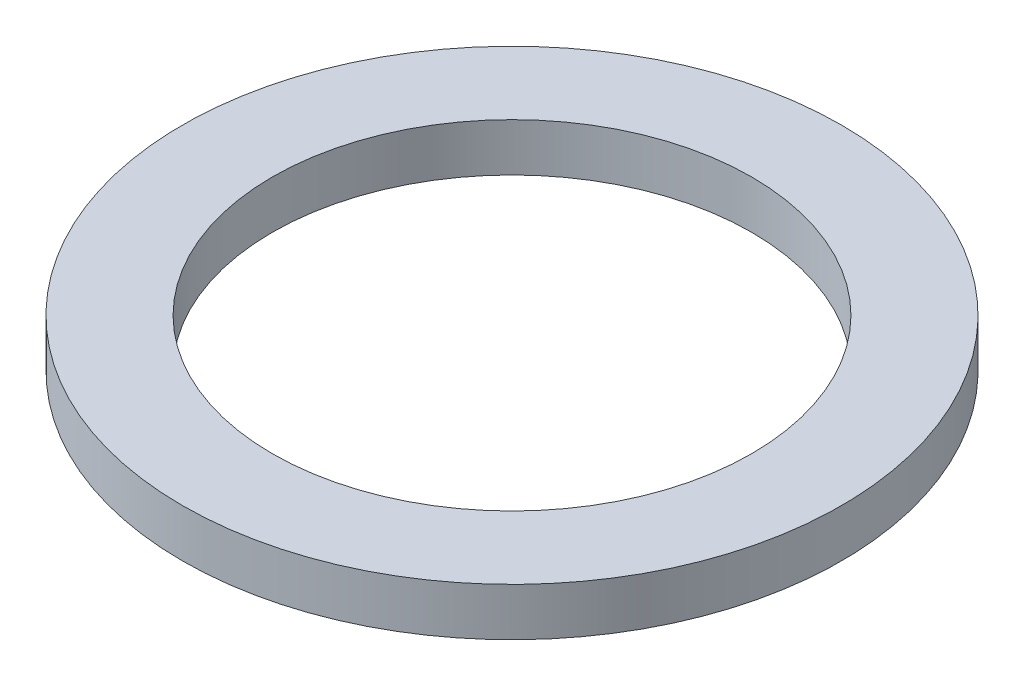
from build123d import *

# Parameters (mm, degrees)
CROQUIS1_R              = 13.75
CROQUIS1_R_2            = 10
SALIENTE_EXTRUIR1_DEPTH = 2


with BuildPart() as part:
    # Croquis1 → Saliente-Extruir1 (new body)
    with BuildSketch(Plane(origin=(0, 0, 0), x_dir=(1, 0, 0), z_dir=(0, 1, 0))):
        with Locations(Location((0, 0, 0), (0, 0, 270))):
            Circle(CROQUIS1_R)
        with Locations(Location((0, 0, 0), (0, 0, 270))):
            Circle(CROQUIS1_R_2, mode=Mode.SUBTRACT)
    extrude(amount=SALIENTE_EXTRUIR1_DEPTH)


solid = part.part
